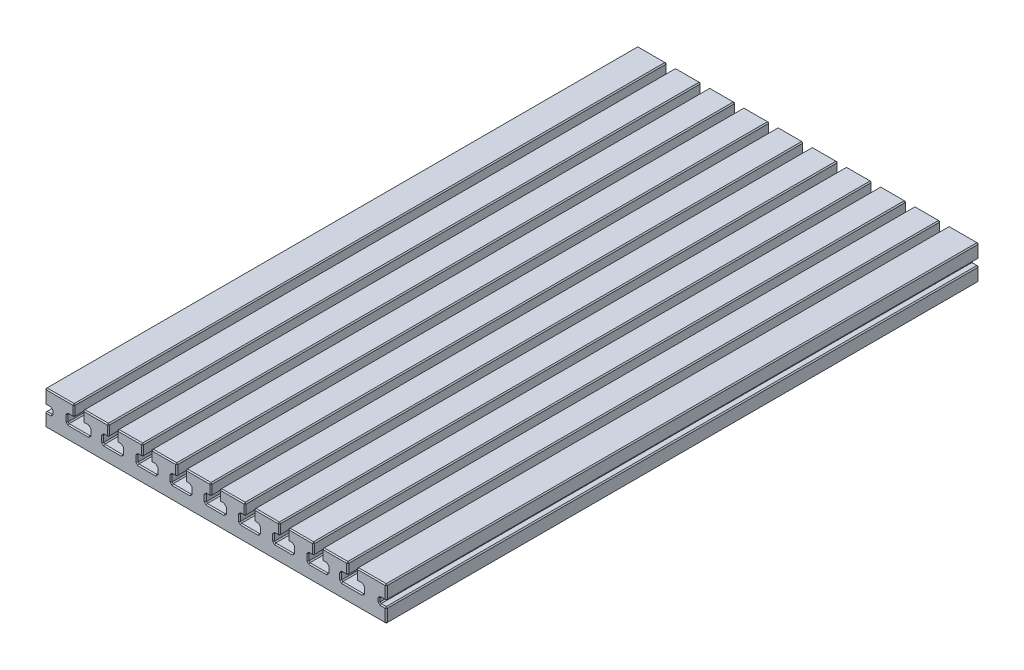
from build123d import *

# Parameters (mm, degrees)
SKETCH1_W          = 760.4125
SKETCH1_H          = 76.2
BASE_EXTRUDE_DEPTH = 1320.8
SKETCH2_W          = 15.875
SKETCH2_H          = 12.7
CUT_EXTRUDE1_DEPTH = 1320.8
CHAMFER1_SIZE      = 2.3622


with BuildPart() as part:
    # Sketch1 → Base-Extrude (new body)
    with BuildSketch(Plane.XY):
        with Locations((0.79375, -38.1)):
            Rectangle(SKETCH1_W, SKETCH1_H)
    extrude(amount=-BASE_EXTRUDE_DEPTH)

    # Sketch2 → Cut-Extrude1 (cut)
    with BuildSketch(Plane.XY):
        Polygon((-9.525, 0), (9.525, 0), (9.525, -25.4), (22.225, -25.4), (22.225, -44.45), (-22.225, -44.45), (-22.225, -25.4), (-9.525, -25.4), align=None)
        Polygon((85.725, -25.4), (98.425, -25.4), (98.425, -44.45), (53.975, -44.45), (53.975, -25.4), (66.675, -25.4), (66.675, 0), (85.725, 0), align=None)
        Polygon((161.925, -25.4), (174.625, -25.4), (174.625, -44.45), (130.175, -44.45), (130.175, -25.4), (142.875, -25.4), (142.875, 0), (161.925, 0), align=None)
        Polygon((-66.675, -25.4), (-53.975, -25.4), (-53.975, -44.45), (-98.425, -44.45), (-98.425, -25.4), (-85.725, -25.4), (-85.725, 0), (-66.675, 0), align=None)
        Polygon((-142.875, -25.4), (-130.175, -25.4), (-130.175, -44.45), (-174.625, -44.45), (-174.625, -25.4), (-161.925, -25.4), (-161.925, 0), (-142.875, 0), align=None)
        Polygon((-219.075, -25.4), (-206.375, -25.4), (-206.375, -44.45), (-250.825, -44.45), (-250.825, -25.4), (-238.125, -25.4), (-238.125, 0), (-219.075, 0), align=None)
        with Locations((373.0625, -37.688218594)):
            Rectangle(SKETCH2_W, SKETCH2_H)
        with Locations((-371.475, -38.898829397)):
            Rectangle(SKETCH2_W, SKETCH2_H)
        Polygon((238.125, -25.4), (250.825, -25.4), (250.825, -44.45), (206.375, -44.45), (206.375, -25.4), (219.075, -25.4), (219.075, 0), (238.125, 0), align=None)
        Polygon((-295.275, -25.4), (-279.4, -25.4), (-279.4, -44.45), (-330.2, -44.45), (-330.2, -25.4), (-314.325, -25.4), (-314.325, 0), (-295.275, 0), align=None)
        Polygon((314.325, -25.4), (330.201668909, -25.4), (330.201668909, -44.45), (279.4, -44.45), (279.4, -25.4), (295.275, -25.4), (295.275, 0), (314.325, 0), align=None)
    extrude(amount=-CUT_EXTRUDE1_DEPTH, mode=Mode.SUBTRACT)

    # Chamfer1
    chamfer1_edges = [part.edges().sort_by_distance(p)[0] for p in [
        (-346.86875, 0, 0),
        (-314.325, 0, -660.4),
        (-346.86875, 0, -1320.8),
        (-379.4125, 0, -660.4),
        (-379.4125, -16.274414699, 0),
        (-371.475, -32.548829397, 0),
        (-363.5375, -38.898829397, 0),
        (-371.475, -45.248829397, 0),
        (-379.4125, -60.724414699, 0),
        (0.79375, -76.2, 0),
        (381, -60.119109297, 0),
        (373.0625, -44.038218594, 0),
        (365.125, -37.688218594, 0),
        (373.0625, -31.338218594, 0),
        (381, -15.669109297, 0),
        (347.6625, 0, 0),
        (314.325, -12.7, 0),
        (322.263334454, -25.4, 0),
        (330.201668909, -34.925, 0),
        (304.800834454, -44.45, 0),
        (279.4, -34.925, 0),
        (287.3375, -25.4, 0),
        (295.275, -12.7, 0),
        (266.7, 0, 0),
        (238.125, -12.7, 0),
        (244.475, -25.4, 0),
        (250.825, -34.925, 0),
        (228.6, -44.45, 0),
        (206.375, -34.925, 0),
        (212.725, -25.4, 0),
        (219.075, -12.7, 0),
        (190.5, 0, 0),
        (161.925, -12.7, 0),
        (168.275, -25.4, 0),
        (174.625, -34.925, 0),
        (152.4, -44.45, 0),
        (130.175, -34.925, 0),
        (136.525, -25.4, 0),
        (142.875, -12.7, 0),
        (114.3, 0, 0),
        (85.725, -12.7, 0),
        (92.075, -25.4, 0),
        (98.425, -34.925, 0),
        (76.2, -44.45, 0),
        (53.975, -34.925, 0),
        (60.325, -25.4, 0),
        (66.675, -12.7, 0),
        (38.1, 0, 0),
        (9.525, -12.7, 0),
        (15.875, -25.4, 0),
        (22.225, -34.925, 0),
        (0, -44.45, 0),
        (-22.225, -34.925, 0),
        (-15.875, -25.4, 0),
        (-9.525, -12.7, 0),
        (-38.1, 0, 0),
        (-66.675, -12.7, 0),
        (-60.325, -25.4, 0),
        (-53.975, -34.925, 0),
        (-76.2, -44.45, 0),
        (-98.425, -34.925, 0),
        (-92.075, -25.4, 0),
        (-85.725, -12.7, 0),
        (-114.3, 0, 0),
        (-142.875, -12.7, 0),
        (-136.525, -25.4, 0),
        (-130.175, -34.925, 0),
        (-152.4, -44.45, 0),
        (-174.625, -34.925, 0),
        (-168.275, -25.4, 0),
        (-161.925, -12.7, 0),
        (-190.5, 0, 0),
        (-219.075, -12.7, 0),
        (-212.725, -25.4, 0),
        (-206.375, -34.925, 0),
        (-228.6, -44.45, 0),
        (-250.825, -34.925, 0),
        (-244.475, -25.4, 0),
        (-238.125, -12.7, 0),
        (-266.7, 0, 0),
        (-295.275, -12.7, 0),
        (-287.3375, -25.4, 0),
        (-279.4, -34.925, 0),
        (-304.8, -44.45, 0),
        (-330.2, -34.925, 0),
        (-322.2625, -25.4, 0),
        (-314.325, -12.7, 0),
        (-314.325, -25.4, -660.4),
        (-314.325, -12.7, -1320.8),
        (-379.4125, -16.274414699, -1320.8),
        (-371.475, -32.548829397, -1320.8),
        (-363.5375, -38.898829397, -1320.8),
        (-371.475, -45.248829397, -1320.8),
        (-379.4125, -60.724414699, -1320.8),
        (0.79375, -76.2, -1320.8),
        (381, -60.119109297, -1320.8),
        (373.0625, -44.038218594, -1320.8),
        (365.125, -37.688218594, -1320.8),
        (373.0625, -31.338218594, -1320.8),
        (381, -15.669109297, -1320.8),
        (347.6625, 0, -1320.8),
        (314.325, -12.7, -1320.8),
        (322.263334454, -25.4, -1320.8),
        (330.201668909, -34.925, -1320.8),
        (304.800834454, -44.45, -1320.8),
        (279.4, -34.925, -1320.8),
        (287.3375, -25.4, -1320.8),
        (295.275, -12.7, -1320.8),
        (266.7, 0, -1320.8),
        (238.125, -12.7, -1320.8),
        (244.475, -25.4, -1320.8),
        (250.825, -34.925, -1320.8),
        (228.6, -44.45, -1320.8),
        (206.375, -34.925, -1320.8),
        (212.725, -25.4, -1320.8),
        (219.075, -12.7, -1320.8),
        (190.5, 0, -1320.8),
        (161.925, -12.7, -1320.8),
        (168.275, -25.4, -1320.8),
        (174.625, -34.925, -1320.8),
        (152.4, -44.45, -1320.8),
        (130.175, -34.925, -1320.8),
        (136.525, -25.4, -1320.8),
        (142.875, -12.7, -1320.8),
        (114.3, 0, -1320.8),
        (85.725, -12.7, -1320.8),
        (92.075, -25.4, -1320.8),
        (98.425, -34.925, -1320.8),
        (76.2, -44.45, -1320.8),
        (53.975, -34.925, -1320.8),
        (60.325, -25.4, -1320.8),
        (66.675, -12.7, -1320.8),
        (38.1, 0, -1320.8),
        (9.525, -12.7, -1320.8),
        (15.875, -25.4, -1320.8),
        (22.225, -34.925, -1320.8),
        (0, -44.45, -1320.8),
        (-22.225, -34.925, -1320.8),
        (-15.875, -25.4, -1320.8),
        (-9.525, -12.7, -1320.8),
        (-38.1, 0, -1320.8),
        (-66.675, -12.7, -1320.8),
        (-60.325, -25.4, -1320.8),
        (-53.975, -34.925, -1320.8),
        (-76.2, -44.45, -1320.8),
        (-98.425, -34.925, -1320.8),
        (-92.075, -25.4, -1320.8),
        (-85.725, -12.7, -1320.8),
        (-114.3, 0, -1320.8),
        (-142.875, -12.7, -1320.8),
        (-136.525, -25.4, -1320.8),
        (-130.175, -34.925, -1320.8),
        (-152.4, -44.45, -1320.8),
        (-174.625, -34.925, -1320.8),
        (-168.275, -25.4, -1320.8),
        (-161.925, -12.7, -1320.8),
        (-190.5, 0, -1320.8),
        (-219.075, -12.7, -1320.8),
        (-212.725, -25.4, -1320.8),
        (-206.375, -34.925, -1320.8),
        (-228.6, -44.45, -1320.8),
        (-250.825, -34.925, -1320.8),
        (-244.475, -25.4, -1320.8),
        (-238.125, -12.7, -1320.8),
        (-266.7, 0, -1320.8),
        (-295.275, -12.7, -1320.8),
        (-287.3375, -25.4, -1320.8),
        (-279.4, -34.925, -1320.8),
        (-304.8, -44.45, -1320.8),
        (-330.2, -34.925, -1320.8),
        (-322.2625, -25.4, -1320.8),
        (-379.4125, -32.548829397, -660.4),
        (-363.5375, -32.548829397, -660.4),
        (-363.5375, -45.248829397, -660.4),
        (-379.4125, -45.248829397, -660.4),
        (-379.4125, -76.2, -660.4),
        (381, -76.2, -660.4),
        (381, -44.038218594, -660.4),
        (365.125, -44.038218594, -660.4),
        (365.125, -31.338218594, -660.4),
        (381, -31.338218594, -660.4),
        (381, 0, -660.4),
        (314.325, 0, -660.4),
        (314.325, -25.4, -660.4),
        (330.201668909, -25.4, -660.4),
        (330.201668909, -44.45, -660.4),
        (279.4, -44.45, -660.4),
        (279.4, -25.4, -660.4),
        (295.275, -25.4, -660.4),
        (295.275, 0, -660.4),
        (238.125, 0, -660.4),
        (238.125, -25.4, -660.4),
        (250.825, -25.4, -660.4),
        (250.825, -44.45, -660.4),
        (206.375, -44.45, -660.4),
        (206.375, -25.4, -660.4),
        (219.075, -25.4, -660.4),
        (219.075, 0, -660.4),
        (161.925, 0, -660.4),
        (161.925, -25.4, -660.4),
        (174.625, -25.4, -660.4),
        (174.625, -44.45, -660.4),
        (130.175, -44.45, -660.4),
        (130.175, -25.4, -660.4),
        (142.875, -25.4, -660.4),
        (142.875, 0, -660.4),
        (85.725, 0, -660.4),
        (85.725, -25.4, -660.4),
        (98.425, -25.4, -660.4),
        (98.425, -44.45, -660.4),
        (53.975, -44.45, -660.4),
        (53.975, -25.4, -660.4),
        (66.675, -25.4, -660.4),
        (66.675, 0, -660.4),
        (9.525, 0, -660.4),
        (9.525, -25.4, -660.4),
        (22.225, -25.4, -660.4),
        (22.225, -44.45, -660.4),
        (-22.225, -44.45, -660.4),
        (-22.225, -25.4, -660.4),
        (-9.525, -25.4, -660.4),
        (-9.525, 0, -660.4),
        (-66.675, 0, -660.4),
        (-66.675, -25.4, -660.4),
        (-53.975, -25.4, -660.4),
        (-53.975, -44.45, -660.4),
        (-98.425, -44.45, -660.4),
        (-98.425, -25.4, -660.4),
        (-85.725, -25.4, -660.4),
        (-85.725, 0, -660.4),
        (-142.875, 0, -660.4),
        (-142.875, -25.4, -660.4),
        (-130.175, -25.4, -660.4),
        (-130.175, -44.45, -660.4),
        (-174.625, -44.45, -660.4),
        (-174.625, -25.4, -660.4),
        (-161.925, -25.4, -660.4),
        (-161.925, 0, -660.4),
        (-219.075, 0, -660.4),
        (-219.075, -25.4, -660.4),
        (-206.375, -25.4, -660.4),
        (-206.375, -44.45, -660.4),
        (-250.825, -44.45, -660.4),
        (-250.825, -25.4, -660.4),
        (-238.125, -25.4, -660.4),
        (-238.125, 0, -660.4),
        (-295.275, 0, -660.4),
        (-295.275, -25.4, -660.4),
        (-279.4, -25.4, -660.4),
        (-279.4, -44.45, -660.4),
        (-330.2, -44.45, -660.4),
        (-330.2, -25.4, -660.4),
    ]]
    chamfer(chamfer1_edges, length=CHAMFER1_SIZE)


solid = part.part
